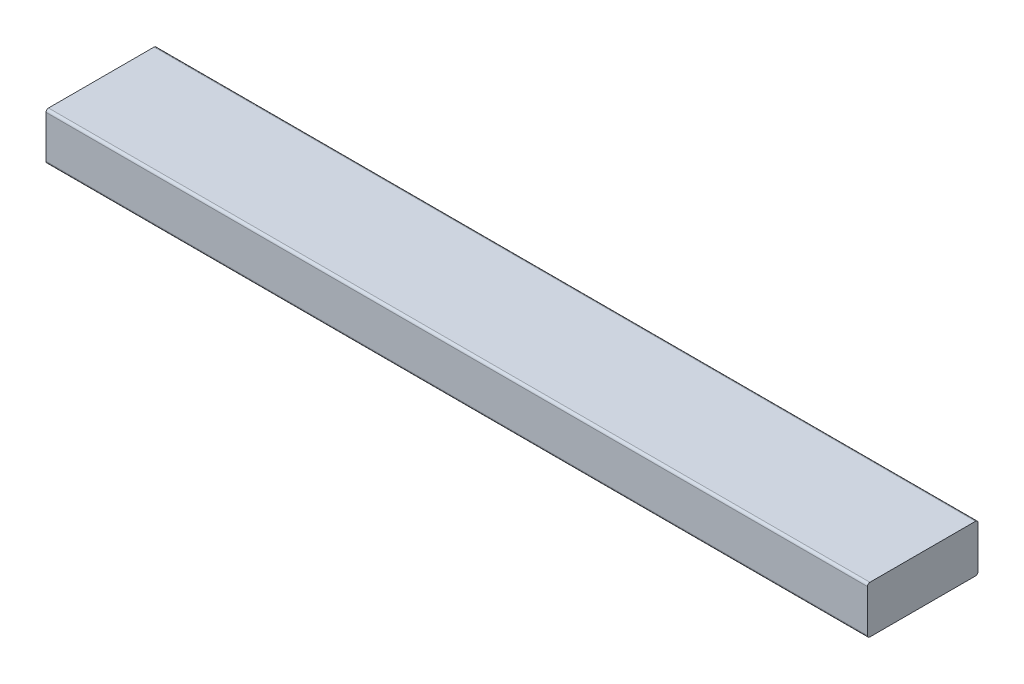
from build123d import *

# Parameters (mm, degrees)
SKETCH1_W           = 88.9
SKETCH1_H           = 38.1
BOSS_EXTRUDE1_DEPTH = 660.4
FILLET1_R           = 2


with BuildPart() as part:
    # Sketch1 → Boss-Extrude1 (new body)
    with BuildSketch(Plane(origin=(0, 0, 0), x_dir=(0, 0, -1), z_dir=(1, 0, 0))):
        Rectangle(SKETCH1_W, SKETCH1_H)
    extrude(amount=BOSS_EXTRUDE1_DEPTH)

    # Fillet1
    fillet1_edges = [part.edges().sort_by_distance(p)[0] for p in [
        (330.2, -19.05, -44.45),
        (330.2, -19.05, 44.45),
        (330.2, 19.05, 44.45),
        (330.2, 19.05, -44.45),
    ]]
    fillet(fillet1_edges, radius=FILLET1_R)


solid = part.part
